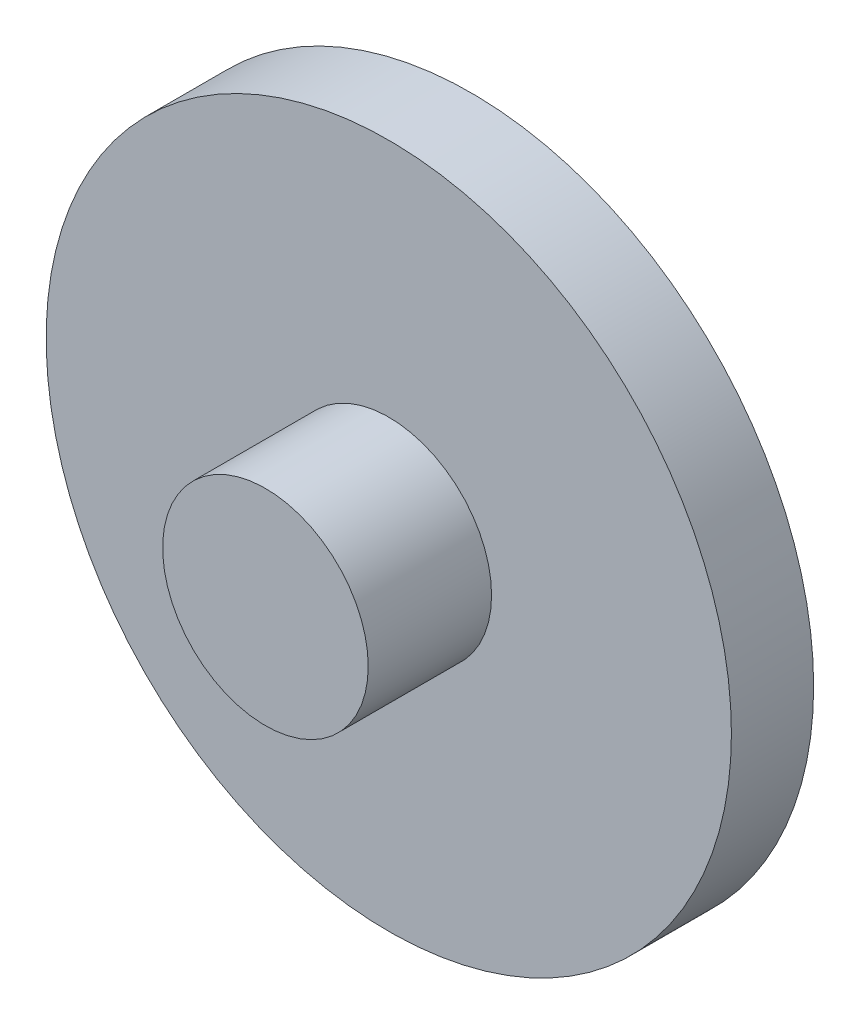
from build123d import *

# Parameters (mm, degrees)
SKETCH_3_R      = 50
BASEDISC_DEPTH  = 12
SKETCH_4_R      = 15
PIVOTBOSS_DEPTH = 18


with BuildPart() as part:
    # 草图3 → BaseDisc (new body)
    with BuildSketch(Plane.XY):
        with Locations((75, 12)):
            Circle(SKETCH_3_R)
    extrude(amount=BASEDISC_DEPTH)

    # 草图4 → PivotBoss (add)
    with BuildSketch(Plane.XY.offset(12)):
        with Locations((75, 12)):
            Circle(SKETCH_4_R)
    extrude(amount=PIVOTBOSS_DEPTH)


solid = part.part
